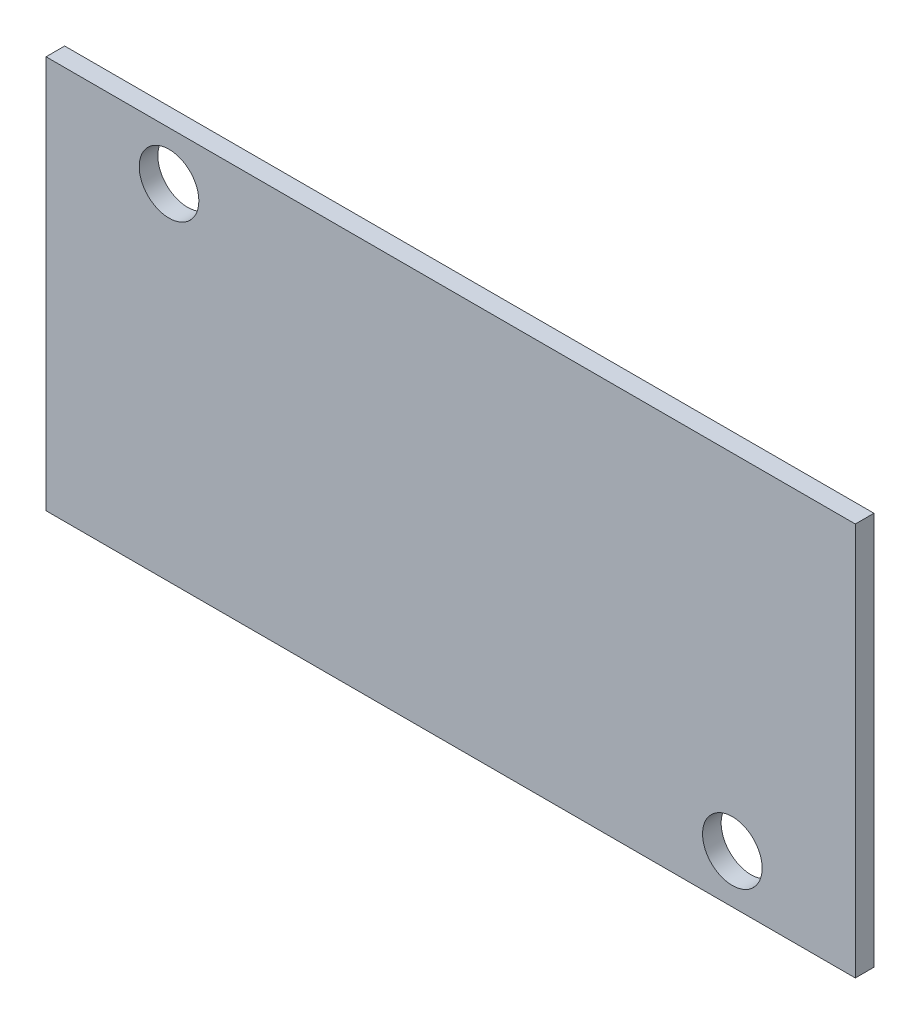
from build123d import *

# Parameters (mm, degrees)
CROQUIS1_W              = 43.43
CROQUIS1_H              = 21.1
CROQUIS1_R              = 1.6
SALIENTE_EXTRUIR1_DEPTH = 1


with BuildPart() as part:
    # Croquis1 → Saliente-Extruir1 (new body)
    with BuildSketch(Plane.XY):
        Rectangle(CROQUIS1_W, CROQUIS1_H)
        with Locations((-15.115, 7.95)):
            Circle(CROQUIS1_R, mode=Mode.SUBTRACT)
        with Locations((15.115, -7.95)):
            Circle(CROQUIS1_R, mode=Mode.SUBTRACT)
    extrude(amount=SALIENTE_EXTRUIR1_DEPTH)


solid = part.part
